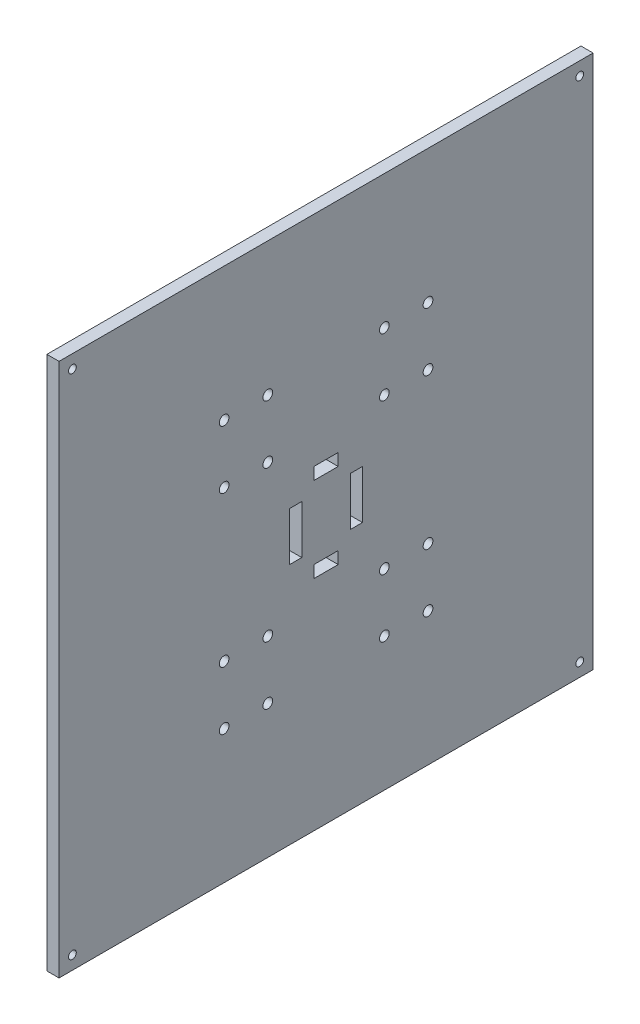
from build123d import *

# Parameters (mm, degrees)
SKETCH_1_W      = 220
SKETCH_1_H      = 220
SKETCH_1_R      = 2
SKETCH_1_R_2    = 1.6
SKETCH_1_W_2    = 5
SKETCH_1_H_2    = 20
SKETCH_1_W_3    = 10
SKETCH_1_H_3    = 5.002557866
SKETCH_1_H_4    = 5
EXTRUDE_1_DEPTH = 5


with BuildPart() as part:
    # 草图1 → 凸台-拉伸1 (new body)
    with BuildSketch(Plane(origin=(0, 0, 0), x_dir=(0, 0, -1), z_dir=(1, 0, 0))):
        with Locations((1.240063593, -23.177255758)):
            Rectangle(SKETCH_1_W, SKETCH_1_H)
        with Locations((-22.759936407, 7.822744242)):
            Circle(SKETCH_1_R, mode=Mode.SUBTRACT)
        with Locations((-40.759936407, 7.822744242)):
            Circle(SKETCH_1_R, mode=Mode.SUBTRACT)
        with Locations((-40.759936407, 31.822744242)):
            Circle(SKETCH_1_R, mode=Mode.SUBTRACT)
        with Locations((-22.759936407, 31.822744242)):
            Circle(SKETCH_1_R, mode=Mode.SUBTRACT)
        with Locations((-22.759936407, -78.177255758)):
            Circle(SKETCH_1_R, mode=Mode.SUBTRACT)
        with Locations((-40.759936407, -78.177255758)):
            Circle(SKETCH_1_R, mode=Mode.SUBTRACT)
        with Locations((-40.759936407, -54.177255758)):
            Circle(SKETCH_1_R, mode=Mode.SUBTRACT)
        with Locations((-22.759936407, -54.177255758)):
            Circle(SKETCH_1_R, mode=Mode.SUBTRACT)
        with Locations((43.240063593, 7.822744242)):
            Circle(SKETCH_1_R, mode=Mode.SUBTRACT)
        with Locations((25.240063593, 7.822744242)):
            Circle(SKETCH_1_R, mode=Mode.SUBTRACT)
        with Locations((25.240063593, 31.822744242)):
            Circle(SKETCH_1_R, mode=Mode.SUBTRACT)
        with Locations((43.240063593, 31.822744242)):
            Circle(SKETCH_1_R, mode=Mode.SUBTRACT)
        with Locations((43.240063593, -78.177255758)):
            Circle(SKETCH_1_R, mode=Mode.SUBTRACT)
        with Locations((25.240063593, -78.177255758)):
            Circle(SKETCH_1_R, mode=Mode.SUBTRACT)
        with Locations((25.240063593, -54.177255758)):
            Circle(SKETCH_1_R, mode=Mode.SUBTRACT)
        with Locations((43.240063593, -54.177255758)):
            Circle(SKETCH_1_R, mode=Mode.SUBTRACT)
        with Locations((105.740063593, 81.322744242)):
            Circle(SKETCH_1_R_2, mode=Mode.SUBTRACT)
        with Locations((-103.259936407, 81.322744242)):
            Circle(SKETCH_1_R_2, mode=Mode.SUBTRACT)
        with Locations((-103.259936407, -127.677255758)):
            Circle(SKETCH_1_R_2, mode=Mode.SUBTRACT)
        with Locations((105.740063593, -127.677255758)):
            Circle(SKETCH_1_R_2, mode=Mode.SUBTRACT)
        with Locations((13.740063593, -23.177255758)):
            Rectangle(SKETCH_1_W_2, SKETCH_1_H_2, mode=Mode.SUBTRACT)
        with Locations((-11.259936407, -23.177255758)):
            Rectangle(SKETCH_1_W_2, SKETCH_1_H_2, mode=Mode.SUBTRACT)
        with Locations((1.240063593, -5.678534691)):
            Rectangle(SKETCH_1_W_3, SKETCH_1_H_3, mode=Mode.SUBTRACT)
        with Locations((1.240063593, -40.677255758)):
            Rectangle(SKETCH_1_W_3, SKETCH_1_H_4, mode=Mode.SUBTRACT)
    extrude(amount=EXTRUDE_1_DEPTH)


solid = part.part
